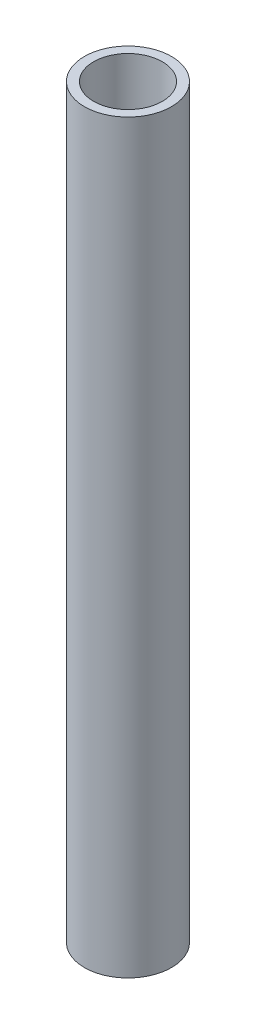
from build123d import *

# Parameters (mm, degrees)
SKETCH1_R           = 24.13
SKETCH1_R_2         = 19.05
BOSS_EXTRUDE1_DEPTH = 206.629


with BuildPart() as part:
    # Sketch1 → Boss-Extrude1 (new, symmetric)
    with BuildSketch(Plane(origin=(0, 0, 0), x_dir=(1, 0, 0), z_dir=(0, 1, 0))):
        with Locations(Location((0, 0, 0), (0, 0, 270))):
            Circle(SKETCH1_R)
        with Locations(Location((0, 0, 0), (0, 0, 270))):
            Circle(SKETCH1_R_2, mode=Mode.SUBTRACT)
    extrude(amount=BOSS_EXTRUDE1_DEPTH, both=True)


solid = part.part
